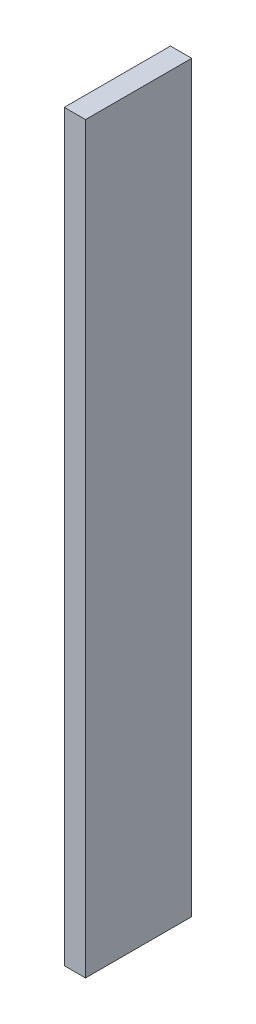
from build123d import *

# Parameters (mm, degrees)
SKETCH3_W           = 10
SKETCH3_H           = 350
BOSS_EXTRUDE2_DEPTH = 50
SKETCH4_R           = 1.4
CUT_EXTRUDE2_DEPTH  = 10


with BuildPart() as part:
    # Sketch3 → Boss-Extrude2 (new body)
    with BuildSketch(Plane.XY):
        with Locations((5, 175)):
            Rectangle(SKETCH3_W, SKETCH3_H)
    extrude(amount=BOSS_EXTRUDE2_DEPTH)

    # Sketch4 → Cut-Extrude2 (cut)
    with BuildSketch(Plane(origin=(0, 0, 0), x_dir=(-1, 0, 0), z_dir=(0, 0, -1))):
        with Locations((-5, 330)):
            Circle(SKETCH4_R)
        with Locations((-5, 20)):
            Circle(SKETCH4_R)
    extrude(amount=-CUT_EXTRUDE2_DEPTH, mode=Mode.SUBTRACT)


solid = part.part
